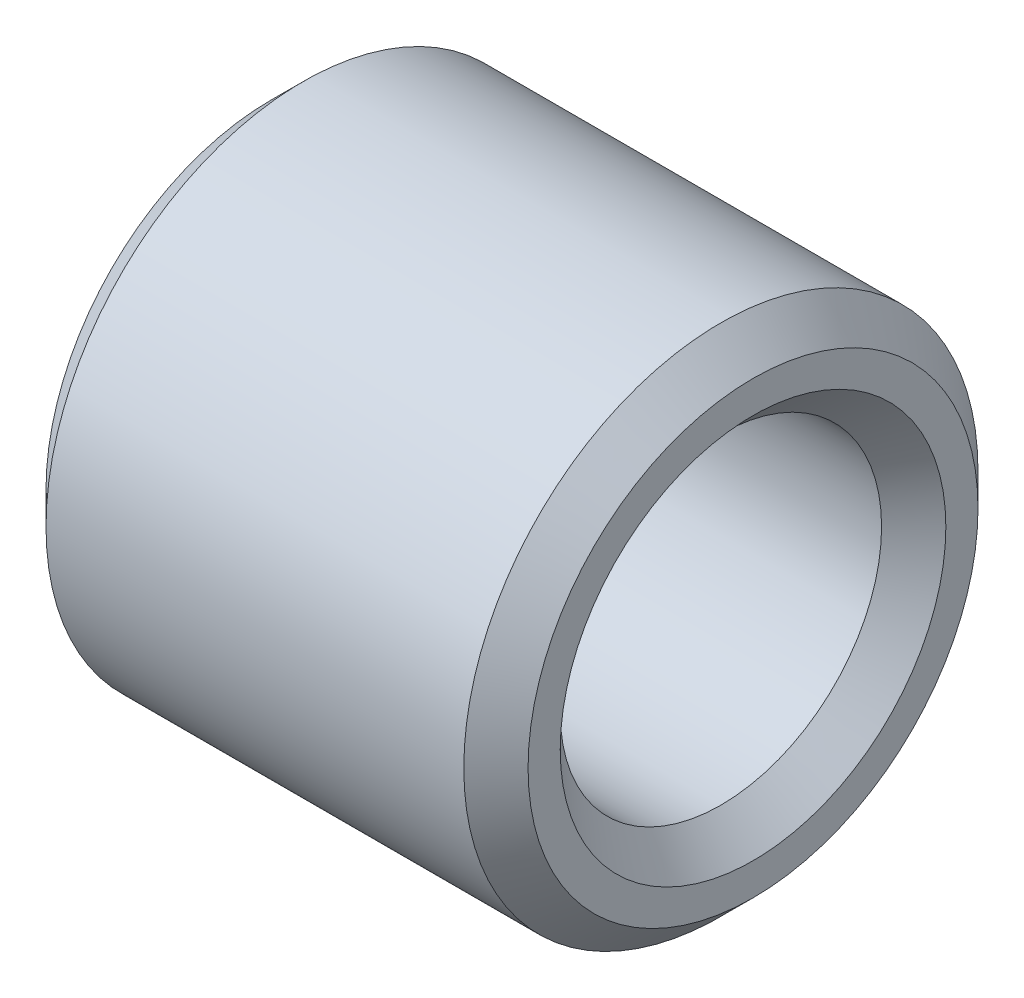
from build123d import *

# Parameters (mm, degrees)
SKETCH_1_R      = 4
SKETCH_1_R_2    = 2.5
EXTRUDE_1_DEPTH = 7.5
CHAMFER_1_SIZE  = 0.5


with BuildPart() as part:
    # 草图1 → 凸台-拉伸1 (new body)
    with BuildSketch(Plane(origin=(0, 0, 0), x_dir=(0, 0, -1), z_dir=(1, 0, 0))):
        Circle(SKETCH_1_R)
        Circle(SKETCH_1_R_2, mode=Mode.SUBTRACT)
    extrude(amount=EXTRUDE_1_DEPTH)

    # 倒角1
    chamfer_1_edges = [part.edges().sort_by_distance(p)[0] for p in [
        (0, 0, 4),
        (7.5, 0, 4),
        (0, 0, 2.5),
        (7.5, 0, 2.5),
    ]]
    chamfer(chamfer_1_edges, length=CHAMFER_1_SIZE)


solid = part.part
